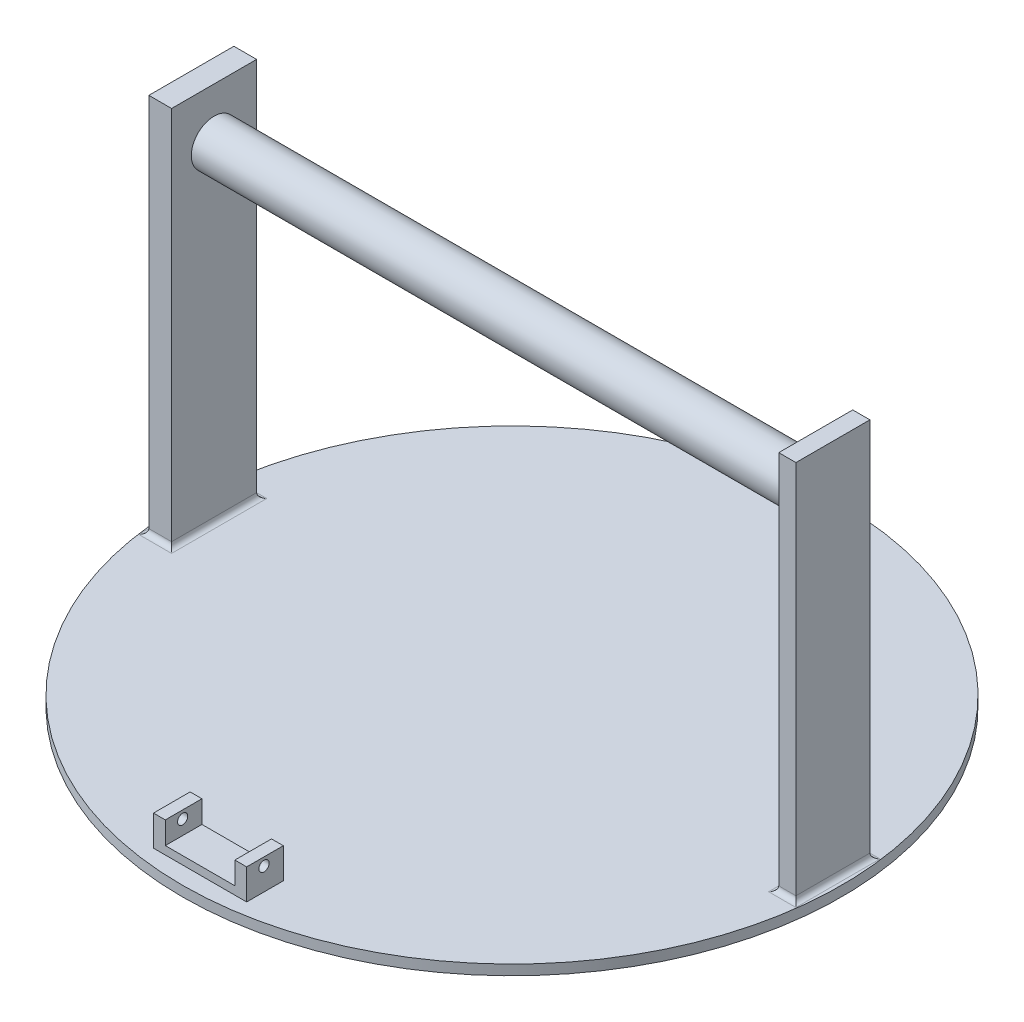
from build123d import *

# Parameters (mm, degrees)
SKETCH1_R           = 650
BOSS_EXTRUDE1_DEPTH = 20
SKETCH2_W           = 33.859391453
SKETCH2_H           = 72.958055336
SKETCH2_W_2         = 44.858886192
SKETCH2_H_2         = 83.856653026
BOSS_EXTRUDE2_DEPTH = 750
SKETCH3_R           = 45
BOSS_EXTRUDE3_DEPTH = 1186.61916287
FILLET1_R           = 10
SKETCH4_W           = 183.78137906
SKETCH4_H           = 72.271116226
BOSS_EXTRUDE4_DEPTH = 60
SKETCH5_W           = 137.162690518
SKETCH5_H           = 87.847771894
CUT_EXTRUDE1_DEPTH  = 139
SKETCH6_R           = 10.058928829
CUT_EXTRUDE2_DEPTH  = 200


with BuildPart() as part:
    # Sketch1 → Boss-Extrude1 (new body)
    with BuildSketch(Plane(origin=(0, 0, 0), x_dir=(1, 0, 0), z_dir=(0, 1, 0))):
        with Locations(Location((0, 0, 0), (0, 0, 270))):
            Circle(SKETCH1_R)
    extrude(amount=BOSS_EXTRUDE1_DEPTH)

    # Sketch2 → Boss-Extrude2 (add)
    with BuildSketch(Plane(origin=(0, 20, 0), x_dir=(1, 0, 0), z_dir=(0, 1, 0))):
        with Locations((616.00396434, -36.479027668)):
            Rectangle(SKETCH2_W, SKETCH2_H)
        with Locations((616.00396434, 36.479027668)):
            Rectangle(SKETCH2_W, SKETCH2_H)
        with Locations((-609.974337352, -41.928326513)):
            Rectangle(SKETCH2_W_2, SKETCH2_H_2)
        with Locations((-609.974337352, 41.928326513)):
            Rectangle(SKETCH2_W_2, SKETCH2_H_2)
    extrude(amount=BOSS_EXTRUDE2_DEPTH)

    # Sketch3 → Boss-Extrude3 (add)
    with BuildSketch(Plane(origin=(-587.544894256, 0, 0), x_dir=(0, 0, -1), z_dir=(1, 0, 0))):
        with Locations(Location((0, 670, 0), (0, 0, 180))):
            Circle(SKETCH3_R)
    extrude(amount=BOSS_EXTRUDE3_DEPTH)

    # Fillet1
    fillet1_edges = [part.edges().sort_by_distance(p)[0] for p in [
        (616.00396434, 20, -72.958055336),
        (-609.974337352, 20, 83.856653026),
        (-587.544894256, 20, 0),
        (-632.403780448, 20, 0),
        (-609.974337352, 20, -83.856653026),
        (616.00396434, 20, 72.958055336),
        (632.933660066, 20, 0),
        (599.074268613, 20, 0),
    ]]
    fillet(fillet1_edges, radius=FILLET1_R)

    # Sketch4 → Boss-Extrude4 (add)
    with BuildSketch(Plane(origin=(0, 20, 0), x_dir=(1, 0, 0), z_dir=(0, 1, 0))):
        with Locations((0, -579.075005183)):
            Rectangle(SKETCH4_W, SKETCH4_H)
    extrude(amount=BOSS_EXTRUDE4_DEPTH)

    # Sketch5 → Cut-Extrude1 (cut)
    with BuildSketch(Plane.XY.offset(615.210563296)):
        with Locations((0, 80)):
            Rectangle(SKETCH5_W, SKETCH5_H)
    extrude(amount=-CUT_EXTRUDE1_DEPTH, mode=Mode.SUBTRACT)

    # Sketch6 → Cut-Extrude2 (cut)
    with BuildSketch(Plane(origin=(91.89068953, 0, 0), x_dir=(0, 0, -1), z_dir=(1, 0, 0))):
        with Locations((-581.015384382, 64.297210262)):
            Circle(SKETCH6_R)
    extrude(amount=-CUT_EXTRUDE2_DEPTH, mode=Mode.SUBTRACT)


solid = part.part
